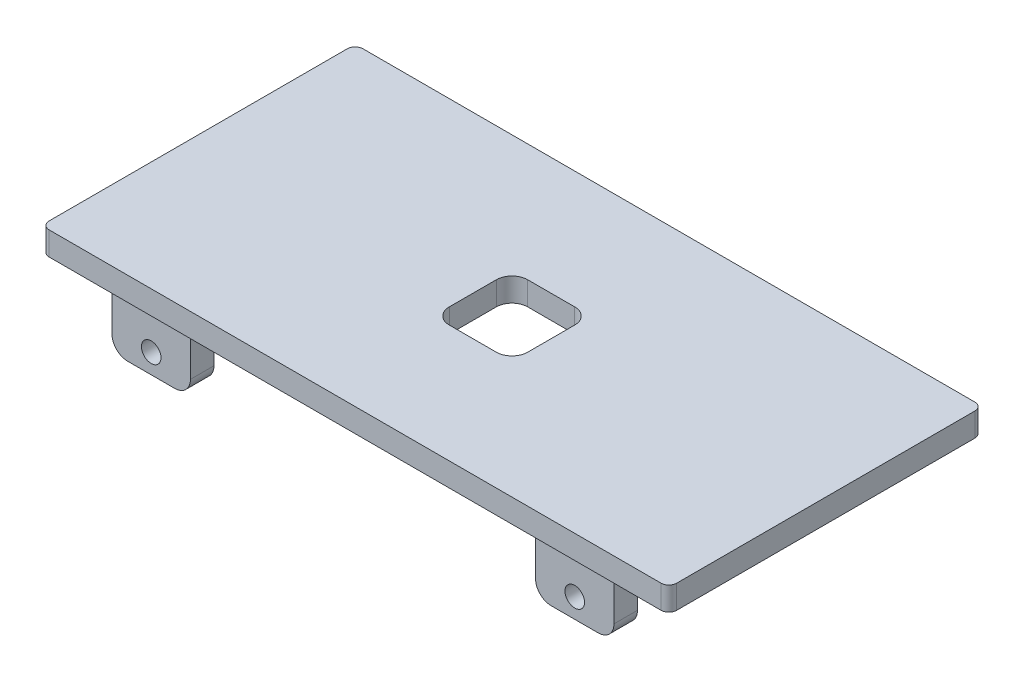
from build123d import *

# Parameters (mm, degrees)
SKETCH1_W           = 800
SKETCH1_H           = 400
BOSS_EXTRUDE1_DEPTH = 30
SKETCH3_W           = 100
SKETCH3_H           = 100
CUT_EXTRUDE1_DEPTH  = 895.930164873
FILLET1_R           = 20
SKETCH4_W           = 100
SKETCH4_H           = 30
BOSS_EXTRUDE2_DEPTH = 75
SKETCH5_R           = 12.5
CUT_EXTRUDE2_DEPTH  = 894.154521905
SKETCH6_R           = 12.5
CUT_EXTRUDE3_DEPTH  = 894.154521905
FILLET2_R           = 20
FILLET3_R           = 10


with BuildPart() as part:
    # Sketch1 → Boss-Extrude1 (new body)
    with BuildSketch(Plane(origin=(0, 0, 0), x_dir=(1, 0, 0), z_dir=(0, 1, 0))):
        with Locations((400, 200)):
            Rectangle(SKETCH1_W, SKETCH1_H)
    extrude(amount=BOSS_EXTRUDE1_DEPTH)

    # Sketch3 → Cut-Extrude1 (cut, through all)
    with BuildSketch(Plane(origin=(0, 30, 0), x_dir=(1, 0, 0), z_dir=(0, 1, 0))):
        with Locations((400, 200)):
            Rectangle(SKETCH3_W, SKETCH3_H)
    extrude(amount=-CUT_EXTRUDE1_DEPTH, mode=Mode.SUBTRACT)

    # Fillet1
    fillet1_edges = [part.edges().sort_by_distance(p)[0] for p in [
        (350, 15, -250),
        (450, 15, -250),
        (450, 15, -150),
        (350, 15, -150),
    ]]
    fillet(fillet1_edges, radius=FILLET1_R)

    # Sketch4 → Boss-Extrude2 (add)
    with BuildSketch(Plane.XZ):
        with Locations((130, -25)):
            Rectangle(SKETCH4_W, SKETCH4_H)
        with Locations((670, -25)):
            Rectangle(SKETCH4_W, SKETCH4_H)
        with Locations((670, -375)):
            Rectangle(SKETCH4_W, SKETCH4_H)
        with Locations((130, -375)):
            Rectangle(SKETCH4_W, SKETCH4_H)
    extrude(amount=BOSS_EXTRUDE2_DEPTH)

    # Sketch5 → Cut-Extrude2 (cut, through all)
    with BuildSketch(Plane.XY.offset(-10)):
        with Locations((130, -50)):
            Circle(SKETCH5_R)
    extrude(amount=-CUT_EXTRUDE2_DEPTH, mode=Mode.SUBTRACT)

    # Sketch6 → Cut-Extrude3 (cut, through all)
    with BuildSketch(Plane.XY.offset(-10)):
        with Locations((670, -50)):
            Circle(SKETCH6_R)
    extrude(amount=-CUT_EXTRUDE3_DEPTH, mode=Mode.SUBTRACT)

    # Fillet2
    fillet2_edges = [part.edges().sort_by_distance(p)[0] for p in [
        (180, -75, -375),
        (80, -75, -375),
        (720, -75, -375),
        (620, -75, -375),
        (620, -75, -25),
        (720, -75, -25),
        (80, -75, -25),
        (180, -75, -25),
    ]]
    fillet(fillet2_edges, radius=FILLET2_R)

    # Fillet3
    fillet3_edges = [part.edges().sort_by_distance(p)[0] for p in [
        (0, 15, -400),
        (800, 15, -400),
        (800, 15, 0),
        (0, 15, 0),
    ]]
    fillet(fillet3_edges, radius=FILLET3_R)


solid = part.part
